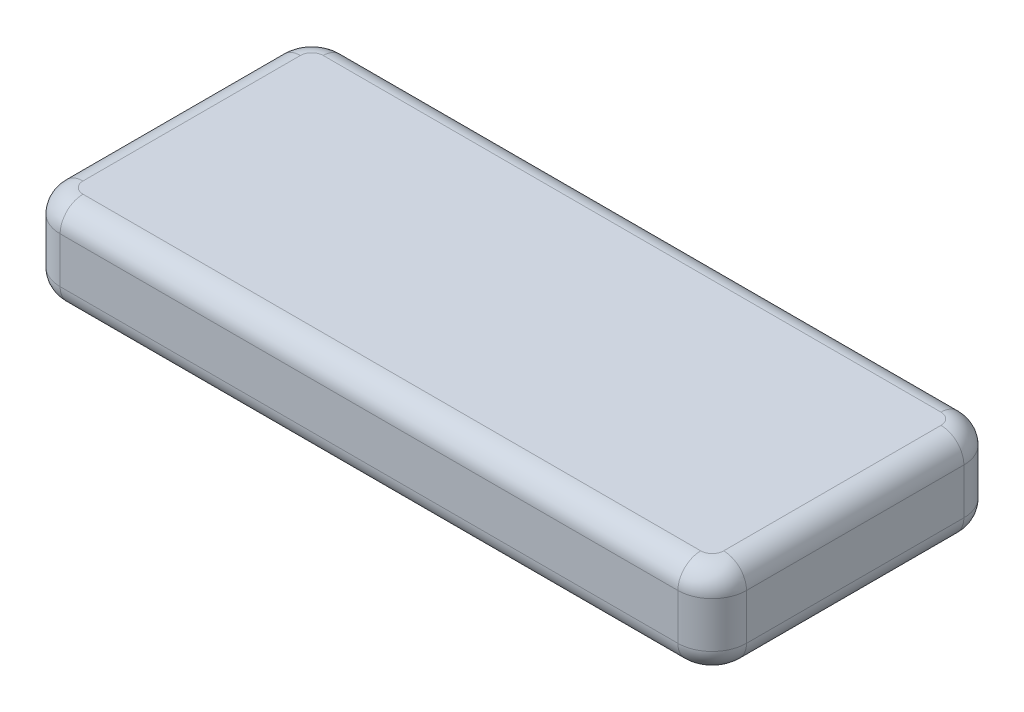
from build123d import *

# Parameters (mm, degrees)
EXTRUDE_1_DEPTH = 4
FILLET_1_R      = 2


with BuildPart() as part:
    # 草图1 → 凸台-拉伸1 (new, symmetric)
    with BuildSketch(Plane(origin=(0, 0, 0), x_dir=(1, 0, 0), z_dir=(0, 1, 0))):
        with BuildLine():
            Line((-27, -12.5), (27, -12.5))
            ThreePointArc((27, -12.5), (29.121320344, -11.621320344), (30, -9.5))
            Line((30, -9.5), (30, 9.5))
            ThreePointArc((30, 9.5), (29.121320344, 11.621320344), (27, 12.5))
            Line((27, 12.5), (-27, 12.5))
            ThreePointArc((-27, 12.5), (-29.121320344, 11.621320344), (-30, 9.5))
            Line((-30, 9.5), (-30, -9.5))
            ThreePointArc((-30, -9.5), (-29.121320344, -11.621320344), (-27, -12.5))
        make_face()
    extrude(amount=EXTRUDE_1_DEPTH, both=True)

    # 圆角1
    fillet_1_edges = [part.edges().sort_by_distance(p)[0] for p in [
        (0, -4, -12.5),
        (29.121320344, -4, -11.621320344),
        (30, -4, 0),
        (29.121320344, -4, 11.621320344),
        (29.121320344, 4, -11.621320344),
        (0, 4, -12.5),
        (-29.121320344, 4, -11.621320344),
        (-30, 4, 0),
        (-29.121320344, 4, 11.621320344),
        (0, 4, 12.5),
        (29.121320344, 4, 11.621320344),
        (0, -4, 12.5),
        (30, 4, 0),
        (-29.121320344, -4, 11.621320344),
        (-30, -4, 0),
        (-29.121320344, -4, -11.621320344),
    ]]
    fillet(fillet_1_edges, radius=FILLET_1_R)


solid = part.part
